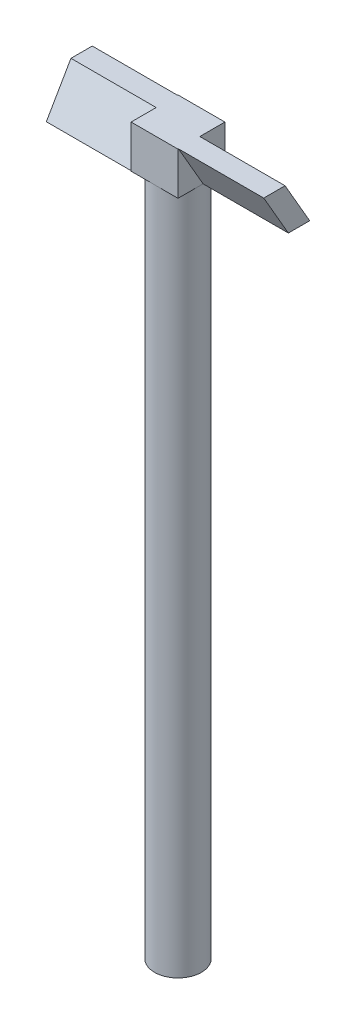
from build123d import *

# Parameters (mm, degrees)
SKETCH1_R           = 5.5
BOSS_EXTRUDE1_DEPTH = 160
SKETCH2_W           = 11
SKETCH2_H           = 11
BOSS_EXTRUDE2_DEPTH = 10
BOSS_EXTRUDE3_DEPTH = 20
CIRPATTERN1_COUNT   = 2
SKETCH4_R           = 1.625
CUT_EXTRUDE1_DEPTH  = 45


with BuildPart() as part:
    # Sketch1 → Boss-Extrude1 (new body)
    with BuildSketch(Plane(origin=(0, 0, 0), x_dir=(1, 0, 0), z_dir=(0, 1, 0))):
        with Locations(Location((0, 0, 0), (0, 0, 270))):
            Circle(SKETCH1_R)
    extrude(amount=BOSS_EXTRUDE1_DEPTH)

    # Sketch2 → Boss-Extrude2 (add)
    with BuildSketch(Plane(origin=(0, 160, 0), x_dir=(1, 0, 0), z_dir=(0, 1, 0))):
        Rectangle(SKETCH2_W, SKETCH2_H)
    extrude(amount=BOSS_EXTRUDE2_DEPTH)

    # Sketch3 → Boss-Extrude3 (add)
    with BuildSketch(Plane.ZY.offset(5.5)):
        Polygon((-5.386751346, 170), (-0.386751346, 170), (5.386751346, 160), (0.386751346, 160), align=None)
    boss_extrude3 = extrude(amount=BOSS_EXTRUDE3_DEPTH)

    # CirPattern1: Boss-Extrude3 ×2 about axis
    cirpattern1_axis = Axis((0, 0, 0), (0, 1, 0))
    for i in range(1, CIRPATTERN1_COUNT):
        add(boss_extrude3.rotate(cirpattern1_axis, i * 360 / CIRPATTERN1_COUNT))

    # Sketch4 → Cut-Extrude1 (cut)
    with BuildSketch(Plane.XZ):
        with Locations(Location((0, 0, 0), (0, 0, 270))):
            Circle(SKETCH4_R)
    extrude(amount=-CUT_EXTRUDE1_DEPTH, mode=Mode.SUBTRACT)


solid = part.part
